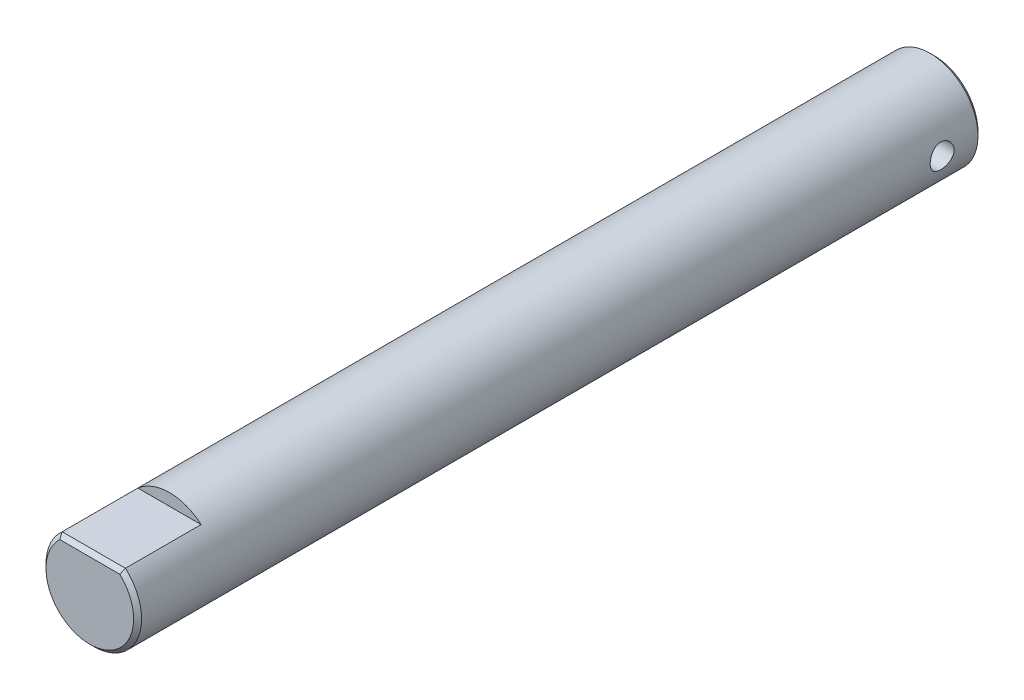
from build123d import *

# Parameters (mm, degrees)
SKETCH1_R               = 6
BOSS_EXTRUDE1_DEPTH     = 106
CUT_EXTRUDE1_DEPTH      = 107.339080304
CUT_EXTRUDE1_DEPTH_BACK = 107.339080304
SKETCH2_R               = 1.5
CUT_EXTRUDE2_DEPTH      = 10
CHAMFER1_SIZE           = 0.5


with BuildPart() as part:
    # Sketch1 → Boss-Extrude1 (new body)
    with BuildSketch(Plane.XY):
        Circle(SKETCH1_R)
    extrude(amount=-BOSS_EXTRUDE1_DEPTH)

    # Sketch2 → Cut-Extrude1 (cut, two sides: drawn at the far end of the back side and taken through both)
    with BuildSketch(Plane(origin=(0, 0, 0), x_dir=(0, 0, -1), z_dir=(1, 0, 0)).offset(-CUT_EXTRUDE1_DEPTH_BACK)):
        with Locations(Location((101, 0, 0), (0, 0, 180))):
            Circle(SKETCH2_R)
    extrude(amount=CUT_EXTRUDE1_DEPTH + CUT_EXTRUDE1_DEPTH_BACK, mode=Mode.SUBTRACT)

    # Sketch3 → Cut-Extrude2 (cut)
    with BuildSketch(Plane.XY):
        with BuildLine():
            Line((-3.968626967, 4.5), (3.968626967, 4.5))
            ThreePointArc((3.968626967, 4.5), (0, 6), (-3.968626967, 4.5))
        make_face()
    extrude(amount=-CUT_EXTRUDE2_DEPTH, mode=Mode.SUBTRACT)

    # Chamfer1
    chamfer1_edges = [part.edges().sort_by_distance(p)[0] for p in [
        (-2.468626967, -5.468626967, 0),
        (0, 4.5, 0),
        (-6, 0, -106),
    ]]
    chamfer(chamfer1_edges, length=CHAMFER1_SIZE)


solid = part.part
